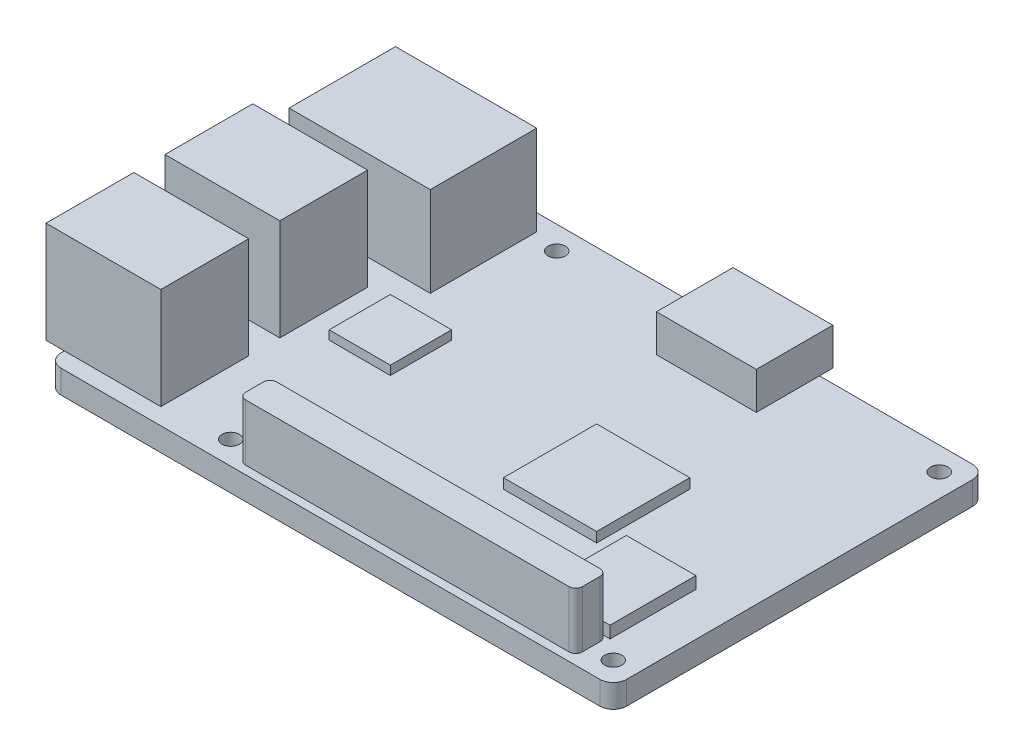
from build123d import *

# Parameters (mm, degrees)
SKETCH1_R           = 1.3
BOSS_EXTRUDE1_DEPTH = 3.5
SKETCH1_3_W         = 21.23
SKETCH1_3_H         = 16
BOSS_EXTRUDE2_DEPTH = 13.5
SKETCH1_4_W         = 17.26
SKETCH1_4_H         = 13.2
BOSS_EXTRUDE3_DEPTH = 15.25
SKETCH1_5_W         = 14
SKETCH1_5_H         = 14
BOSS_EXTRUDE4_DEPTH = 1.5
SKETCH1_6_W         = 15
SKETCH1_6_H         = 11.5
BOSS_EXTRUDE5_DEPTH = 5.6
SKETCH1_7_W         = 9.2
SKETCH1_7_H         = 9.2
BOSS_EXTRUDE6_DEPTH = 1.35
SKETCH1_8_W         = 10.45
SKETCH1_8_H         = 12.9
BOSS_EXTRUDE7_DEPTH = 1.8
BOSS_EXTRUDE8_DEPTH = 8.5
CUT_EXTRUDE1_DEPTH  = 10


with BuildPart() as part:
    # Sketch1 → Boss-Extrude1 (new body)
    with BuildSketch(Plane(origin=(0, 0, 0), x_dir=(1, 0, 0), z_dir=(0, 1, 0))):
        with BuildLine():
            ThreePointArc((0, 2), (0.585786438, 0.585786438), (2, 0))
            Line((2, 0), (83, 0))
            ThreePointArc((83, 0), (84.414213562, 0.585786438), (85, 2))
            Line((85, 2), (85, 54))
            ThreePointArc((85, 54), (84.414213562, 55.414213562), (83, 56))
            Line((83, 56), (2, 56))
            ThreePointArc((2, 56), (0.585786438, 55.414213562), (0, 54))
            Line((0, 54), (0, 2))
        make_face()
        with Locations((24, 3.5)):
            Circle(SKETCH1_R, mode=Mode.SUBTRACT)
        with Locations((81.5, 3.5)):
            Circle(SKETCH1_R, mode=Mode.SUBTRACT)
        with Locations((24, 52.5)):
            Circle(SKETCH1_R, mode=Mode.SUBTRACT)
        with Locations((81.5, 52.5)):
            Circle(SKETCH1_R, mode=Mode.SUBTRACT)
    extrude(amount=-BOSS_EXTRUDE1_DEPTH)

    # Sketch1<3> → Boss-Extrude2 (add)
    with BuildSketch(Plane(origin=(0, 0, 0), x_dir=(1, 0, 0), z_dir=(0, 1, 0))):
        with Locations((9.385, 45.5)):
            Rectangle(SKETCH1_3_W, SKETCH1_3_H)
    extrude(amount=BOSS_EXTRUDE2_DEPTH)

    # Sketch1<4> → Boss-Extrude3 (add)
    with BuildSketch(Plane(origin=(0, 0, 0), x_dir=(1, 0, 0), z_dir=(0, 1, 0))):
        with Locations((5.87, 9.1)):
            Rectangle(SKETCH1_4_W, SKETCH1_4_H)
        with Locations((5.87, 26.98)):
            Rectangle(SKETCH1_4_W, SKETCH1_4_H)
    extrude(amount=BOSS_EXTRUDE3_DEPTH)

    # Sketch1<5> → Boss-Extrude4 (add)
    with BuildSketch(Plane(origin=(0, 0, 0), x_dir=(1, 0, 0), z_dir=(0, 1, 0))):
        with Locations((58, 24.5)):
            Rectangle(SKETCH1_5_W, SKETCH1_5_H)
    extrude(amount=BOSS_EXTRUDE4_DEPTH)

    # Sketch1<6> → Boss-Extrude5 (add)
    with BuildSketch(Plane(origin=(0, 0, 0), x_dir=(1, 0, 0), z_dir=(0, 1, 0))):
        with Locations((52.5, 52.25)):
            Rectangle(SKETCH1_6_W, SKETCH1_6_H)
    extrude(amount=BOSS_EXTRUDE5_DEPTH)

    # Sketch1<7> → Boss-Extrude6 (add)
    with BuildSketch(Plane(origin=(0, 0, 0), x_dir=(1, 0, 0), z_dir=(0, 1, 0))):
        with Locations((23.1, 28.4)):
            Rectangle(SKETCH1_7_W, SKETCH1_7_H)
    extrude(amount=BOSS_EXTRUDE6_DEPTH)

    # Sketch1<8> → Boss-Extrude7 (add)
    with BuildSketch(Plane(origin=(0, 0, 0), x_dir=(1, 0, 0), z_dir=(0, 1, 0))):
        with Locations((73.275, 12.468354001)):
            Rectangle(SKETCH1_8_W, SKETCH1_8_H)
    extrude(amount=BOSS_EXTRUDE7_DEPTH)

    # Sketch1<9> → Boss-Extrude8 (add)
    with BuildSketch(Plane(origin=(0, 0, 0), x_dir=(1, 0, 0), z_dir=(0, 1, 0))):
        with BuildLine():
            ThreePointArc((27.5, 2.25), (27.792893219, 1.542893219), (28.5, 1.25))
            Line((28.5, 1.25), (77.1, 1.25))
            ThreePointArc((77.1, 1.25), (77.807106781, 1.542893219), (78.1, 2.25))
            Line((78.1, 2.25), (78.1, 4.918354001))
            ThreePointArc((78.1, 4.918354001), (77.807106781, 5.625460782), (77.1, 5.918354001))
            Line((77.1, 5.918354001), (28.5, 5.918354001))
            ThreePointArc((28.5, 5.918354001), (27.792893219, 5.625460782), (27.5, 4.918354001))
            Line((27.5, 4.918354001), (27.5, 2.25))
        make_face()
    extrude(amount=BOSS_EXTRUDE8_DEPTH)

    # Sketch3 → Cut-Extrude1 (cut)
    with BuildSketch(Plane.ZY.offset(1.23)):
        Polygon((-51.4, 10.7), (-39.6, 10.7), (-39.6, 4.03), (-42.41, 4.03), (-42.41, 0.23), (-48.59, 0.23), (-48.59, 4.03), (-51.4, 4.03), align=None)
    extrude(amount=-CUT_EXTRUDE1_DEPTH, mode=Mode.SUBTRACT)


solid = part.part
